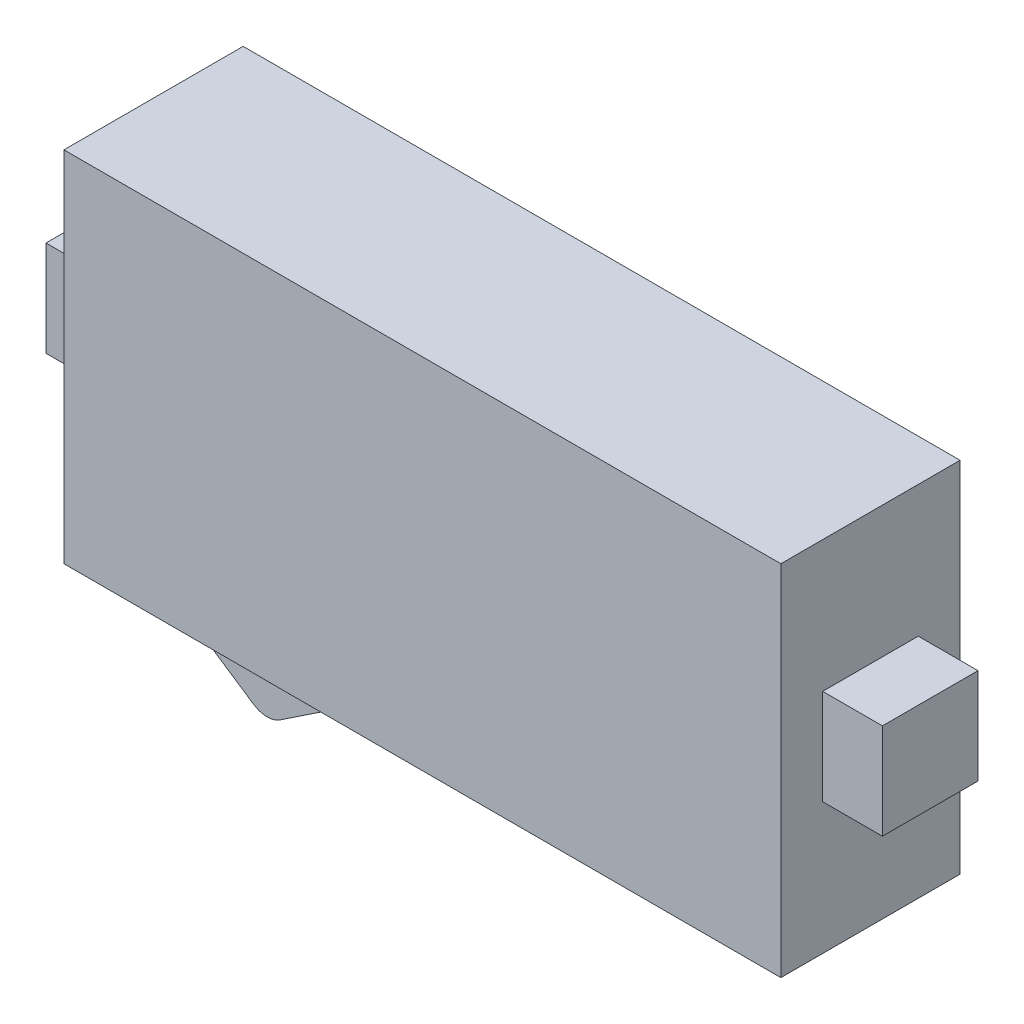
from build123d import *

# Parameters (mm, degrees)
SKETCH_1_W      = 30
SKETCH_1_H      = 15
EXTRUDE_1_DEPTH = 3.75
SKETCH_2_W      = 4
SKETCH_2_H      = 4
EXTRUDE_2_DEPTH = 2.5
EXTRUDE_3_DEPTH = 2.25
FILLET_1_R      = 1


with BuildPart() as part:
    # 草图1 → 凸台-拉伸1 (new, symmetric)
    with BuildSketch(Plane.XY):
        Rectangle(SKETCH_1_W, SKETCH_1_H)
    extrude(amount=EXTRUDE_1_DEPTH, both=True)

    # 草图2 → 凸台-拉伸2 (add)
    with BuildSketch(Plane.ZY.offset(15)):
        Rectangle(SKETCH_2_W, SKETCH_2_H)
    extrude_2 = extrude(amount=EXTRUDE_2_DEPTH)

    # 镜向1: 凸台-拉伸2 across plane
    add(extrude_2.mirror(Plane(origin=(0, 0, 0), x_dir=(0, 0, 1), z_dir=(1, 0, 0))))

    # 草图4 → 凸台-拉伸3 (add, symmetric)
    with BuildSketch(Plane.XY):
        Polygon((-12.5, -7.5), (-8, -10.5), (-3.5, -7.5), align=None)
    extrude(amount=EXTRUDE_3_DEPTH, both=True)

    # 圆角1
    fillet_1_edges = [part.edges().sort_by_distance(p)[0] for p in [
        (-8, -10.5, 0),
    ]]
    fillet(fillet_1_edges, radius=FILLET_1_R)


solid = part.part
